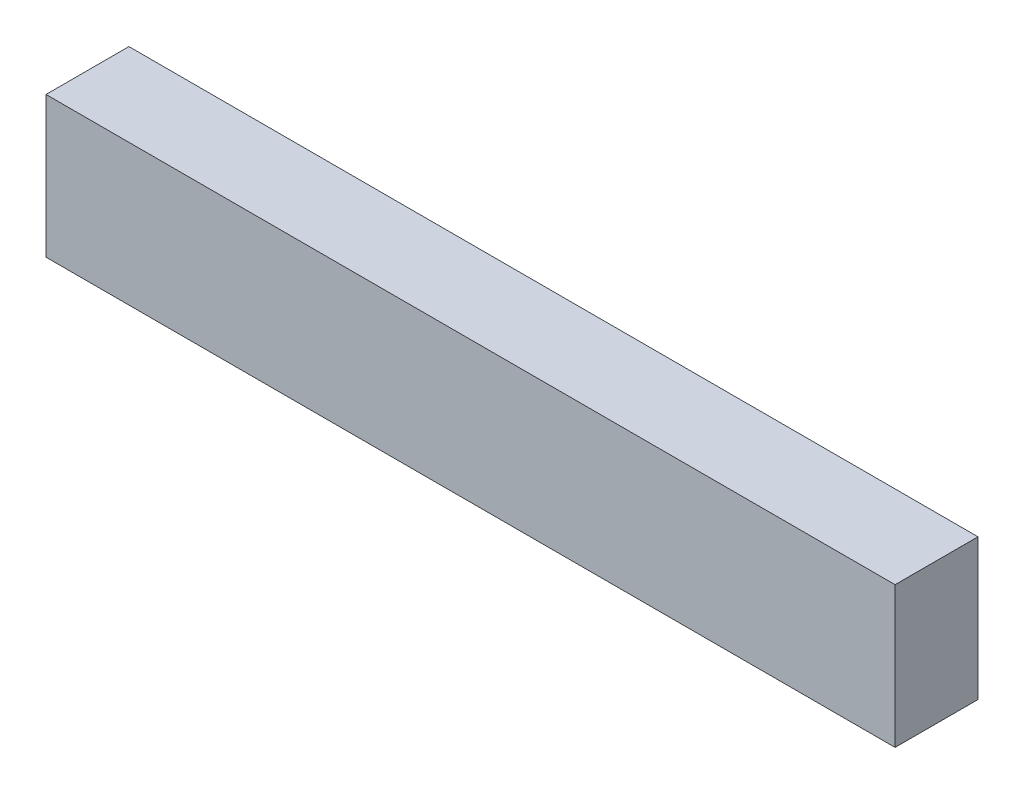
from build123d import *

# Parameters (mm, degrees)
SKETCH1_W           = 51.2
SKETCH1_H           = 5
BOSS_EXTRUDE1_DEPTH = 8.5


with BuildPart() as part:
    # Sketch1 → Boss-Extrude1 (new body)
    with BuildSketch(Plane(origin=(0, 0, 0), x_dir=(1, 0, 0), z_dir=(0, 1, 0))):
        Rectangle(SKETCH1_W, SKETCH1_H)
    extrude(amount=BOSS_EXTRUDE1_DEPTH)


solid = part.part
